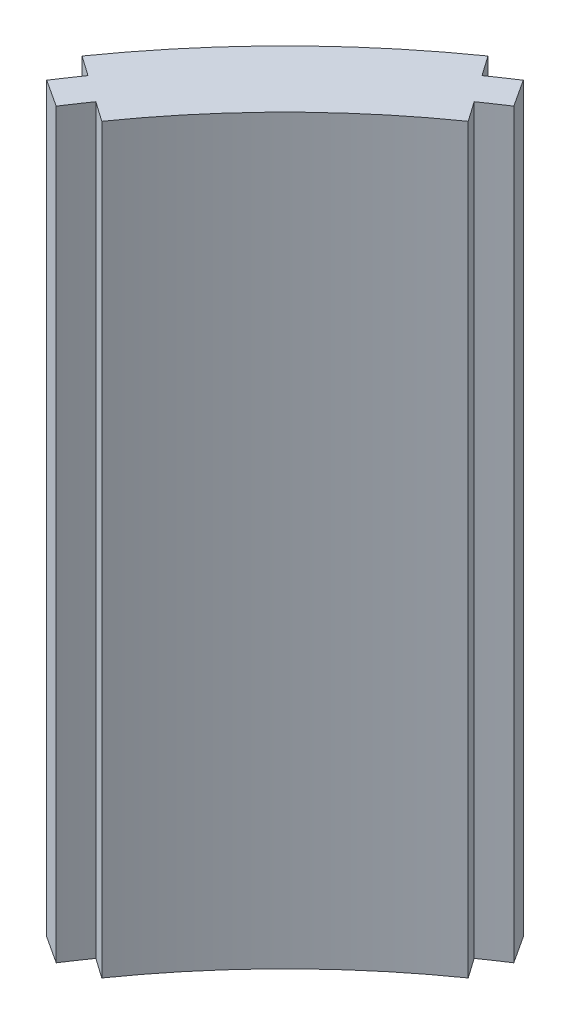
from build123d import *

# Parameters (mm, degrees)
BOSS_EXTRUDE1_DEPTH = 32


with BuildPart() as part:
    # Sketch1 → Boss-Extrude1 (new body)
    with BuildSketch(Plane(origin=(0, 0, 0), x_dir=(1, 0, 0), z_dir=(0, 1, 0))):
        with BuildLine():
            Line((-29.453389827, 20.700189074), (-28.594332624, 20.096433559))
            ThreePointArc((-28.594332624, 20.096433559), (-28.957796954, 19.569069869), (-29.31153635, 19.035134274))
            Line((-29.31153635, 19.035134274), (-28.138728286, 18.270590315))
            ThreePointArc((-28.138728286, 18.270590315), (-27.798512026, 18.784174965), (-27.44892302, 19.291426206))
            Line((-27.44892302, 19.291426206), (-26.589865816, 18.687670691))
            ThreePointArc((-26.589865816, 18.687670691), (-22.980970389, 22.980970389), (-18.687670691, 26.589865816))
            Line((-18.687670691, 26.589865816), (-19.291426206, 27.44892302))
            ThreePointArc((-19.291426206, 27.44892302), (-18.784174965, 27.798512026), (-18.270590315, 28.138728286))
            Line((-18.270590315, 28.138728286), (-19.035134274, 29.31153635))
            ThreePointArc((-19.035134274, 29.31153635), (-19.569069869, 28.957796954), (-20.096433559, 28.594332624))
            Line((-20.096433559, 28.594332624), (-20.700189074, 29.453389827))
            ThreePointArc((-20.700189074, 29.453389827), (-25.455844123, 25.455844123), (-29.453389827, 20.700189074))
        make_face()
    extrude(amount=BOSS_EXTRUDE1_DEPTH)


solid = part.part
